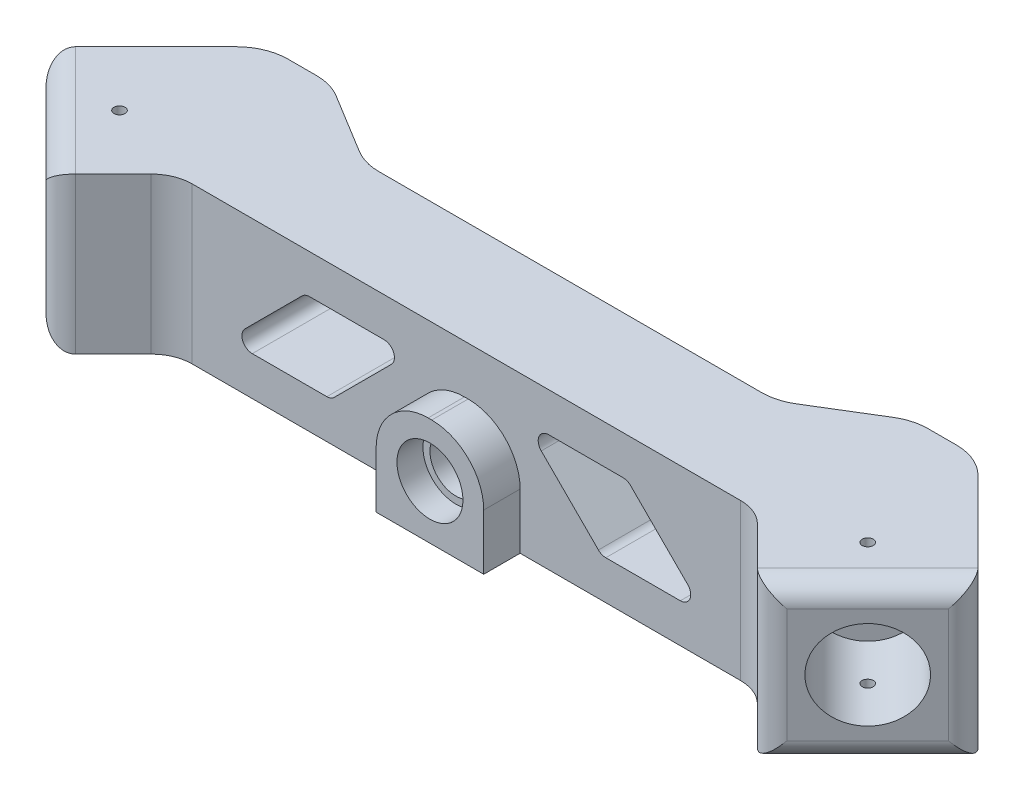
from build123d import *

# Parameters (mm, degrees)
BOSS_EXTRUDE1_DEPTH     = 38.1
SKETCH2_R               = 10.8585
CUT_EXTRUDE1_DEPTH      = 25.4
SKETCH3_R               = 10.8585
CUT_EXTRUDE2_DEPTH      = 25.4
FILLET1_R               = 10
SKETCH5_W               = 26.289
SKETCH5_H               = 26.289
BOSS_EXTRUDE2_DEPTH     = 8.89
SKETCH6_R               = 8.0645
CUT_EXTRUDE3_DEPTH      = 6.35
SKETCH7_R               = 6.35
CUT_EXTRUDE4_DEPTH      = 5.08
FILLET3_R               = 12.7
FILLET4_R               = 5.08
FILLET5_R               = 12.7
CUT_EXTRUDE5_DEPTH      = 191.631332173
CUT_EXTRUDE5_DEPTH_BACK = 191.631332173
SKETCH8_R               = 1.349999967
CUT_EXTRUDE6_DEPTH      = 191.631332193
CUT_EXTRUDE6_DEPTH_BACK = 191.631332193
FILLET6_R               = 2.54


with BuildPart() as part:
    # Sketch1 → Boss-Extrude1 (new body)
    with BuildSketch(Plane(origin=(0, 0, 0), x_dir=(1, 0, 0), z_dir=(0, 1, 0))):
        Polygon((-15.781536726, 38.1), (0, 38.1), (20.791856291, 25.4), (121.448143709, 25.4), (142.24, 38.1), (158.021536726, 38.1), (184.96230509, 11.159231637), (158.021536726, -15.781536726), (142.24, 0), (0, 0), (-15.781536726, -15.781536726), (-42.72230509, 11.159231637), align=None)
    extrude(amount=BOSS_EXTRUDE1_DEPTH)

    # Sketch2 → Cut-Extrude1 (cut)
    with BuildSketch(Plane(origin=(-15.781536726, 0, 15.781536726), x_dir=(0.7071067811865477, 0, 0.7071067811865475), z_dir=(-0.7071067811865475, 0, 0.7071067811865477))):
        with Locations((-19.05, 19.05)):
            Circle(SKETCH2_R)
    extrude(amount=-CUT_EXTRUDE1_DEPTH, mode=Mode.SUBTRACT)

    # Sketch3 → Cut-Extrude2 (cut)
    with BuildSketch(Plane(origin=(86.901536726, 0, 86.901536726), x_dir=(0.7071067811865478, 0, -0.7071067811865474), z_dir=(0.7071067811865474, 0, 0.7071067811865478))):
        with Locations((119.628868556, 19.05)):
            Circle(SKETCH3_R)
    extrude(amount=-CUT_EXTRUDE2_DEPTH, mode=Mode.SUBTRACT)

    # Fillet1
    fillet1_edges = [part.edges().sort_by_distance(p)[0] for p in [
        (142.24, 19.05, 0),
        (0, 19.05, 0),
    ]]
    fillet(fillet1_edges, radius=FILLET1_R)

    # Sketch5 → Boss-Extrude2 (add)
    with BuildSketch(Plane.XY):
        with Locations((71.12, 13.1445)):
            Rectangle(SKETCH5_W, SKETCH5_H)
    extrude(amount=BOSS_EXTRUDE2_DEPTH)

    # Sketch6 → Cut-Extrude3 (cut)
    with BuildSketch(Plane.XY.offset(8.89)):
        with Locations((71.12, 13.1445)):
            Circle(SKETCH6_R)
    extrude(amount=-CUT_EXTRUDE3_DEPTH, mode=Mode.SUBTRACT)

    # Sketch7 → Cut-Extrude4 (cut)
    with BuildSketch(Plane.XY.offset(2.54)):
        with Locations((71.12, 13.1445)):
            Circle(SKETCH7_R)
    extrude(amount=-CUT_EXTRUDE4_DEPTH, mode=Mode.SUBTRACT)

    # Fillet3
    fillet3_edges = [part.edges().sort_by_distance(p)[0] for p in [
        (57.9755, 26.289, 4.445),
        (84.2645, 26.289, 4.445),
    ]]
    fillet(fillet3_edges, radius=FILLET3_R)

    # Fillet4
    fillet4_edges = [part.edges().sort_by_distance(p)[0] for p in [
        (-29.251920908, 0, 2.311152545),
        (171.491920908, 0, 2.311152545),
        (171.491920908, 38.1, 2.311152545),
        (-15.781536726, 19.05, 15.781536726),
        (-42.72230509, 19.05, -11.159231637),
        (184.96230509, 19.05, -11.159231637),
        (158.021536726, 19.05, 15.781536726),
        (-29.251920908, 38.1, 2.311152545),
    ]]
    fillet(fillet4_edges, radius=FILLET4_R)

    # Fillet5
    fillet5_edges = [part.edges().sort_by_distance(p)[0] for p in [
        (-15.781536726, 19.05, -38.1),
        (0, 19.05, -38.1),
        (20.791856291, 19.05, -25.4),
        (121.448143709, 19.05, -25.4),
        (142.24, 19.05, -38.1),
        (158.021536726, 19.05, -38.1),
    ]]
    fillet(fillet5_edges, radius=FILLET5_R)

    # Sketch8 → Cut-Extrude5 (cut, two sides: drawn at the far end of the back side and taken through both)
    with BuildSketch(Plane(origin=(0, 38.1, 0), x_dir=(1, 0, 0), z_dir=(0, 1, 0)).offset(-CUT_EXTRUDE5_DEPTH_BACK)):
        with Locations(Location((-20.271664787, 6.669103576, 0), (0, 0, 270))):
            Circle(SKETCH8_R)
        with Locations(Location((162.511664787, 6.669103576, 0), (0, 0, 270))):
            Circle(SKETCH8_R)
    extrude(amount=CUT_EXTRUDE5_DEPTH + CUT_EXTRUDE5_DEPTH_BACK, mode=Mode.SUBTRACT)

    # Sketch9 → Cut-Extrude6 (cut, two sides: drawn at the far end of the back side and taken through both)
    with BuildSketch(Plane.XY.offset(-CUT_EXTRUDE6_DEPTH_BACK)):
        Polygon((12.7, 9.525), (38.1, 9.525), (57.15, 28.575), (31.75, 28.575), align=None)
        Polygon((85.09, 28.575), (110.49, 28.575), (129.54, 9.525), (104.14, 9.525), align=None)
    extrude(amount=CUT_EXTRUDE6_DEPTH + CUT_EXTRUDE6_DEPTH_BACK, mode=Mode.SUBTRACT)

    # Fillet6
    fillet6_edges = [part.edges().sort_by_distance(p)[0] for p in [
        (129.54, 9.525, -15.17131794),
        (110.49, 28.575, -12.7),
        (85.09, 28.575, -12.7),
        (104.14, 9.525, -12.7),
        (38.1, 9.525, -12.7),
        (57.15, 28.575, -12.7),
        (31.75, 28.575, -12.7),
        (12.7, 9.525, -15.17131794),
    ]]
    fillet(fillet6_edges, radius=FILLET6_R)


solid = part.part
